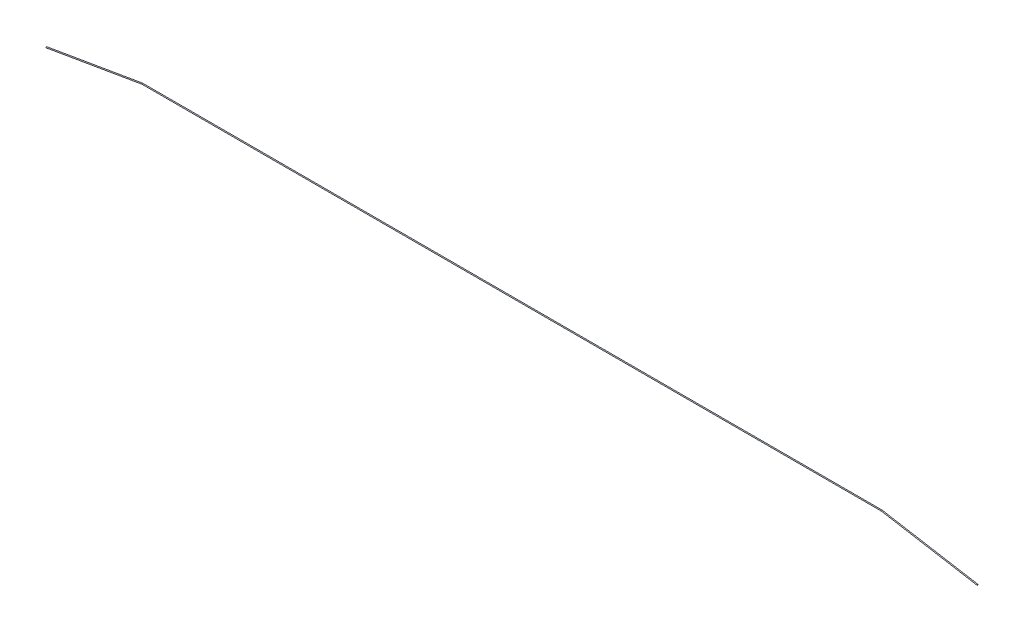
from build123d import *

# Parameters (mm, degrees)
SWEEP1_PROFILE_R = 0.0254


with BuildPart() as part:
    # Sweep1: sweep along a path in Sketch1
    with BuildLine(Plane.XY) as sweep1_path:
        Line((25.5905, 22.225), (20.32, 23.125282015))
        Line((20.32, 23.125282015), (-20.32, 23.125282015))
        Line((-20.32, 23.125282015), (-25.5905, 22.225))
    # Sweep1 profile (on start of the path) → Sweep1 (sweep)
    with BuildSketch(Plane(origin=(25.5905, 22.225, 0), x_dir=(-0.16837652342244713, -0.9857227532933234, 0), z_dir=(-0.9857227532933234, 0.16837652342244713, 0))):
        Circle(SWEEP1_PROFILE_R)
    sweep(path=sweep1_path.line, transition=Transition.RIGHT)


solid = part.part
